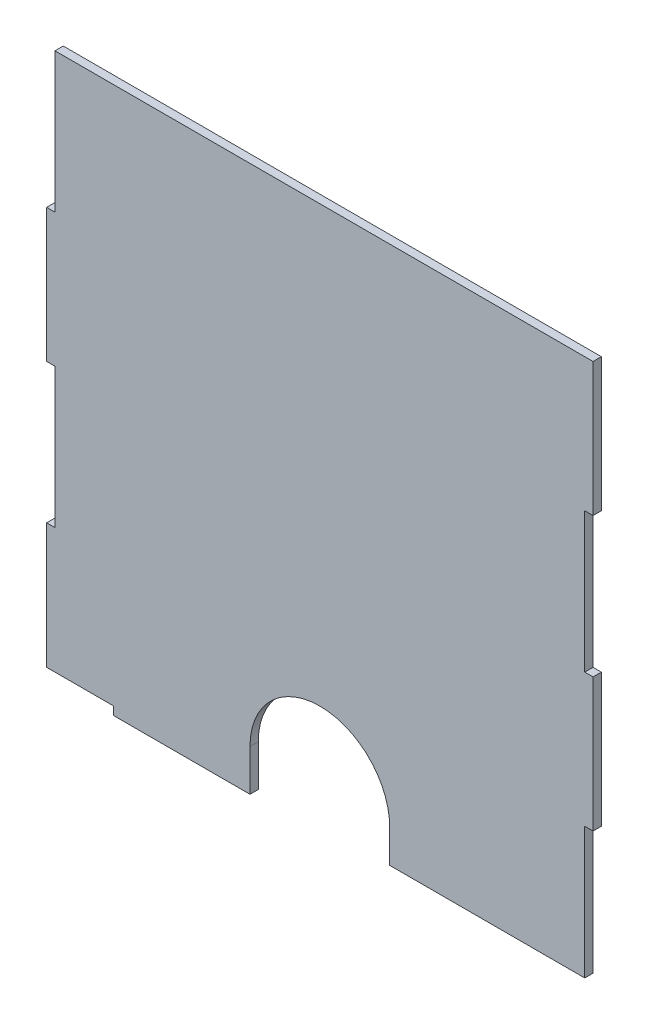
from build123d import *

# Parameters (mm, degrees)
BOSS_EXTRUDE1_DEPTH = 6


with BuildPart() as part:
    # Sketch1 → Boss-Extrude1 (new body)
    with BuildSketch(Plane.XY):
        with BuildLine():
            Line((-149, -191.5), (-149, -197.5))
            Line((-149, -197.5), (-50.5, -197.5))
            Line((-50.5, -197.5), (-50.5, -167.5))
            ThreePointArc((-50.5, -167.5), (0, -117), (50.5, -167.5))
            Line((50.5, -167.5), (50.5, -191.5))
            Line((50.5, -191.5), (191.5, -191.5))
            Line((191.5, -191.5), (191.5, -96.5))
            Line((191.5, -96.5), (197.5, -96.5))
            Line((197.5, -96.5), (197.5, 0))
            Line((197.5, 0), (191.5, 0))
            Line((191.5, 0), (191.5, 101))
            Line((191.5, 101), (197.5, 101))
            Line((197.5, 101), (197.5, 197.5))
            Line((197.5, 197.5), (-191.5, 197.5))
            Line((-191.5, 197.5), (-191.5, 96.5))
            Line((-191.5, 96.5), (-197.5, 96.5))
            Line((-197.5, 96.5), (-197.5, 0))
            Line((-197.5, 0), (-191.5, 0))
            Line((-191.5, 0), (-191.5, -101))
            Line((-191.5, -101), (-197.5, -101))
            Line((-197.5, -101), (-197.5, -191.5))
            Line((-197.5, -191.5), (-149, -191.5))
        make_face()
    extrude(amount=BOSS_EXTRUDE1_DEPTH)


solid = part.part
